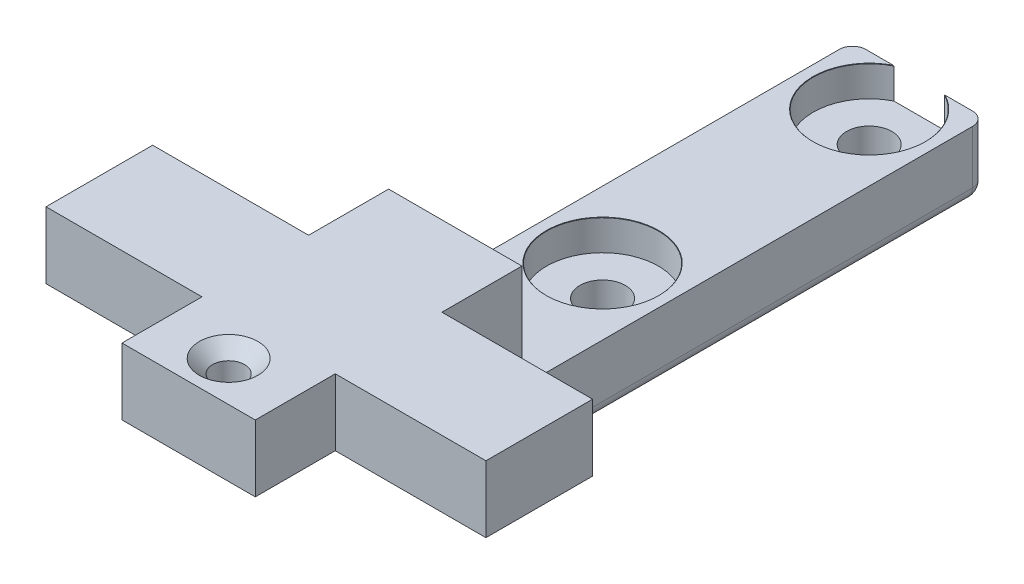
from build123d import *

# Parameters (mm, degrees)
SKETCH1_W                                       = 10
SKETCH1_H                                       = 40.8
BOSS_EXTRUDE1_DEPTH                             = 5
SKETCH7_W                                       = 10
SKETCH7_H                                       = 6
BOSS_EXTRUDE2_DEPTH                             = 7.83
SKETCH8_W                                       = 33
SKETCH8_H                                       = 5
BOSS_EXTRUDE3_DEPTH                             = 8
SKETCH9_W                                       = 10
SKETCH9_H                                       = 5
BOSS_EXTRUDE4_DEPTH                             = 6
CSK_FOR_M2_FLAT_HEAD_MACHINE_SCREW1_D           = 2.4
CSK_FOR_M2_FLAT_HEAD_MACHINE_SCREW1_CSINK_D     = 4.4
CSK_FOR_M2_FLAT_HEAD_MACHINE_SCREW1_CSINK_ANGLE = 90
CBORE_FOR_M3_HEX_HEAD_MACHINE_SCREW1_AT_COUNT   = 2
CBORE_FOR_M3_HEX_HEAD_MACHINE_SCREW1_AT_PITCH   = 20
FILLET1_R                                       = 1


with BuildPart() as part:
    # Sketch1 → Boss-Extrude1 (new body)
    with BuildSketch(Plane(origin=(0, 0, 0), x_dir=(1, 0, 0), z_dir=(0, 1, 0))):
        with Locations((5, 24.563754531)):
            Rectangle(SKETCH1_W, SKETCH1_H)
    extrude(amount=BOSS_EXTRUDE1_DEPTH)

    # Sketch7 → Boss-Extrude2 (add)
    with BuildSketch(Plane(origin=(0, 5, 0), x_dir=(1, 0, 0), z_dir=(0, 1, 0))):
        with Locations((5, 7.163754531)):
            Rectangle(SKETCH7_W, SKETCH7_H)
    extrude(amount=BOSS_EXTRUDE2_DEPTH)

    # Sketch8 → Boss-Extrude3 (add)
    with BuildSketch(Plane.XY.offset(-4.163754531)):
        with Locations((4.8, 10.33)):
            Rectangle(SKETCH8_W, SKETCH8_H)
    extrude(amount=BOSS_EXTRUDE3_DEPTH)

    # Sketch9 → Boss-Extrude4 (add)
    with BuildSketch(Plane.XY.offset(3.836245469)):
        with Locations((5, 10.33)):
            Rectangle(SKETCH9_W, SKETCH9_H)
    extrude(amount=BOSS_EXTRUDE4_DEPTH)

    # CSK for M2 Flat Head Machine Screw1 (through all)
    with Locations(Plane(origin=(0, 12.83, 0), x_dir=(1, 0, 0), z_dir=(0, 1, 0))):
        with Locations((5, -6.836245469)):
            CounterSinkHole(CSK_FOR_M2_FLAT_HEAD_MACHINE_SCREW1_D / 2, CSK_FOR_M2_FLAT_HEAD_MACHINE_SCREW1_CSINK_D / 2, counter_sink_angle=CSK_FOR_M2_FLAT_HEAD_MACHINE_SCREW1_CSINK_ANGLE)

    # Sketch13 → CBORE for M3 Hex Head Machine Screw1 (revolve, cut)
    with BuildSketch(Plane(origin=(5, 5, -21.213754531), x_dir=(0, 0, 1), z_dir=(1, 0, 0))):
        Polygon((0, 0), (0, 5), (1.7, 5), (1.7, 2.3), (4.2, 2.3), (4.2, 0.025), (4.225, 0), align=None)
    cbore_for_m3_hex_head_machine_screw1 = revolve(axis=Axis((5, 11.35, -21.213754531), (0, -1, 0)), mode=Mode.SUBTRACT)

    # CBORE for M3 Hex Head Machine Screw1 at: CBORE for M3 Hex Head Machine Screw1 ×2
    with Locations(*[(0, 0, -i * CBORE_FOR_M3_HEX_HEAD_MACHINE_SCREW1_AT_PITCH) for i in range(1, CBORE_FOR_M3_HEX_HEAD_MACHINE_SCREW1_AT_COUNT)]):
        add(cbore_for_m3_hex_head_machine_screw1, mode=Mode.SUBTRACT)

    # Fillet1
    fillet1_edges = [part.edges().sort_by_distance(p)[0] for p in [
        (5, 7.83, -4.163754531),
        (5, 0, -44.963754531),
        (10, 0, -24.563754531),
        (5, 0, -4.163754531),
        (0, 0, -24.563754531),
        (0, 2.5, -44.963754531),
        (10, 2.5, -44.963754531),
    ]]
    fillet(fillet1_edges, radius=FILLET1_R)


solid = part.part
